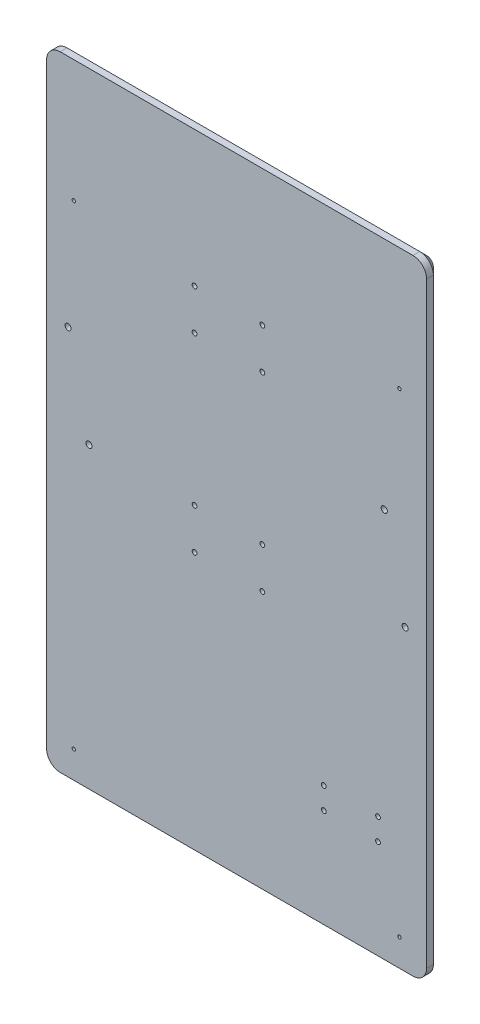
from build123d import *

# Parameters (mm, degrees)
SKICA1_W                 = 280
SKICA1_H                 = 460
P_IDAT_VYSUNUT_M1_DEPTH  = 10
SKICA3_R                 = 1.75
SKICA3_R_2               = 2.25
ODEBRAT_VYSUNUT_M1_DEPTH = 10
SKICA4_R                 = 1.25
ODEBRAT_VYSUNUT_M2_DEPTH = 10
ZAOBLIT1_R               = 10
ZKOSEN_1_SIZE            = 5


with BuildPart() as part:
    # Skica1 → Přidat vysunutím1 (new body)
    with BuildSketch(Plane.XY):
        with Locations((6, 4.9692)):
            Rectangle(SKICA1_W, SKICA1_H)
    extrude(amount=P_IDAT_VYSUNUT_M1_DEPTH)

    # Skica3 → Odebrat vysunutím1 (cut)
    with BuildSketch(Plane.XY.offset(10)):
        with Locations((25, 135)):
            Circle(SKICA3_R)
        with Locations((25, 105)):
            Circle(SKICA3_R)
        with Locations((-25, 135)):
            Circle(SKICA3_R)
        with Locations((-25, 105)):
            Circle(SKICA3_R)
        with Locations((-102.8, -5.1992)):
            Circle(SKICA3_R_2)
        with Locations((110.186658443, -152.108914912)):
            Circle(SKICA3_R)
        with Locations((110.204187307, -136.108924514)):
            Circle(SKICA3_R)
        with Locations((70.309542186, -152.214237593)):
            Circle(SKICA3_R)
        with Locations((70.207496415, -136.214563013)):
            Circle(SKICA3_R)
        with Locations((114.8, 62.2008)):
            Circle(SKICA3_R_2)
        with Locations((130.2, -5.1992)):
            Circle(SKICA3_R_2)
        with Locations((-118.2, 62.2008)):
            Circle(SKICA3_R_2)
        with Locations((25, -5)):
            Circle(SKICA3_R)
        with Locations((25, -35)):
            Circle(SKICA3_R)
        with Locations((-25, -35)):
            Circle(SKICA3_R)
        with Locations((-25, -5)):
            Circle(SKICA3_R)
    extrude(amount=-ODEBRAT_VYSUNUT_M1_DEPTH, mode=Mode.SUBTRACT)

    # Skica4 → Odebrat vysunutím2 (cut)
    with BuildSketch(Plane.XY.offset(10)):
        with Locations((126, 144.9692)):
            Circle(SKICA4_R)
        with Locations((126, -205.0308)):
            Circle(SKICA4_R)
        with Locations((-114, -205.0308)):
            Circle(SKICA4_R)
        with Locations((-114, 144.9692)):
            Circle(SKICA4_R)
    extrude(amount=-ODEBRAT_VYSUNUT_M2_DEPTH, mode=Mode.SUBTRACT)

    # Zaoblit1
    zaoblit1_edges = [part.edges().sort_by_distance(p)[0] for p in [
        (146, -225.0308, 5),
        (-134, -225.0308, 5),
        (-134, 234.9692, 5),
        (146, 234.9692, 5),
    ]]
    fillet(zaoblit1_edges, radius=ZAOBLIT1_R)

    # Zkosení1
    zkosen_1_edges = [part.edges().sort_by_distance(p)[0] for p in [
        (6, -225.0308, 0),
        (146, 4.9692, 0),
        (-134, 4.9692, 0),
        (6, 234.9692, 0),
        (143.071067812, -222.101867812, 0),
        (143.071067812, 232.040267812, 0),
        (-131.071067812, 232.040267812, 0),
        (-131.071067812, -222.101867812, 0),
    ]]
    chamfer(zkosen_1_edges, length=ZKOSEN_1_SIZE)


solid = part.part
